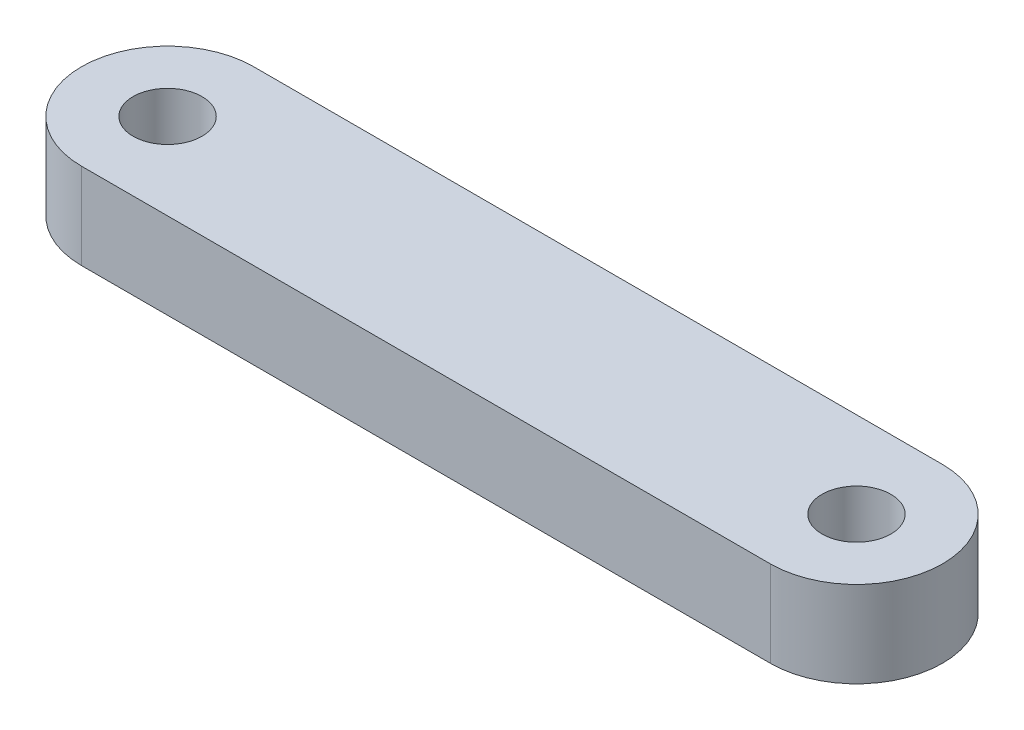
from build123d import *

# Parameters (mm, degrees)
BOSS_EXTRUDE1_DEPTH = 50
SKETCH2_R           = 20
CUT_EXTRUDE1_DEPTH  = 50


with BuildPart() as part:
    # Sketch1 → Boss-Extrude1 (new body)
    with BuildSketch(Plane(origin=(0, 0, 0), x_dir=(1, 0, 0), z_dir=(0, 1, 0))):
        with BuildLine():
            Line((-58.599273321, 50), (341.400726679, 50))
            ThreePointArc((341.400726679, 50), (391.400726679, 0), (341.400726679, -50))
            Line((341.400726679, -50), (-58.599273321, -50))
            ThreePointArc((-58.599273321, -50), (-108.599273321, 0), (-58.599273321, 50))
        make_face()
    extrude(amount=BOSS_EXTRUDE1_DEPTH)

    # Sketch2 → Cut-Extrude1 (cut)
    with BuildSketch(Plane(origin=(0, 50, 0), x_dir=(1, 0, 0), z_dir=(0, 1, 0))):
        with Locations(Location((-58.599273321, 0, 0), (0, 0, 270))):
            Circle(SKETCH2_R)
        with Locations(Location((341.400726679, 0, 0), (0, 0, 270))):
            Circle(SKETCH2_R)
    extrude(amount=-CUT_EXTRUDE1_DEPTH, mode=Mode.SUBTRACT)


solid = part.part
